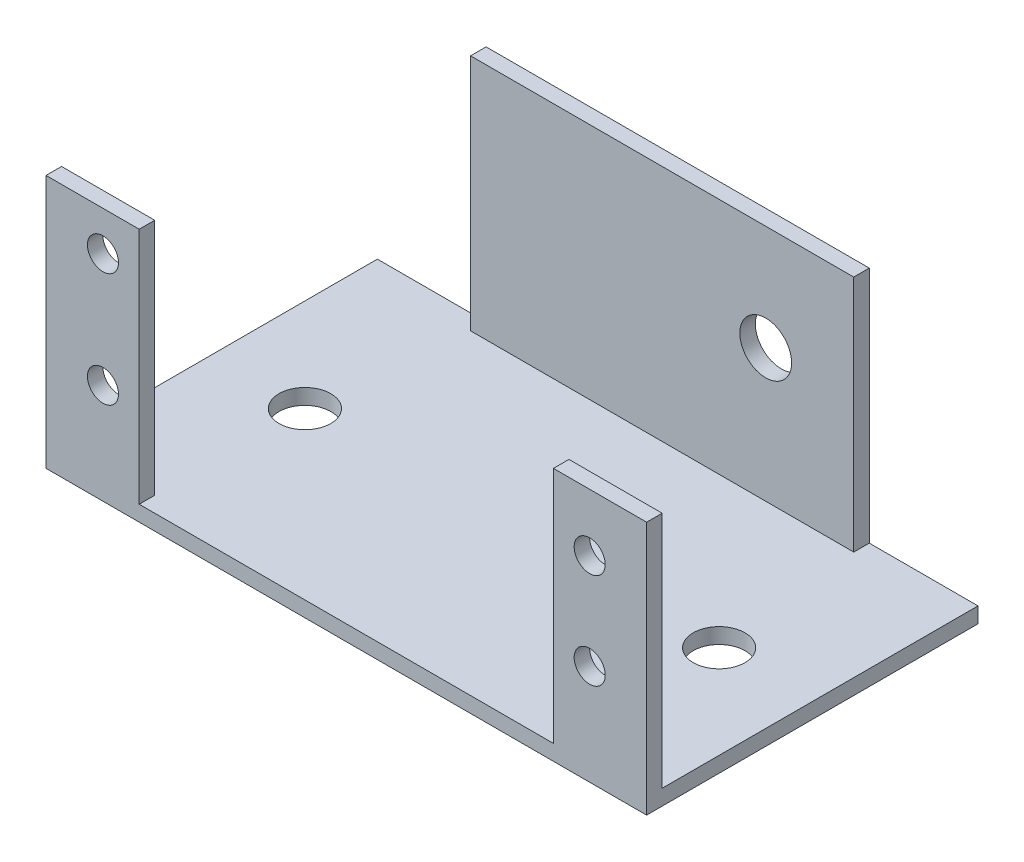
from build123d import *

# Parameters (mm, degrees)
SKETCH1_W           = 58
SKETCH1_H           = 32
BOSS_EXTRUDE1_DEPTH = 1.5
SKETCH1_3_W         = 9
SKETCH1_3_H         = 1.5
BOSS_EXTRUDE2_DEPTH = 23
SKETCH2_R           = 1.5
CUT_EXTRUDE1_DEPTH  = 49.928519291
SKETCH1_4_W         = 37
SKETCH1_4_H         = 1.5
BOSS_EXTRUDE3_DEPTH = 23
SKETCH3_R           = 2.5
CUT_EXTRUDE2_DEPTH  = 48.960921592
SKETCH1_5_R         = 2.5
CUT_EXTRUDE3_DEPTH  = 25


with BuildPart() as part:
    # Sketch1 → Boss-Extrude1 (new body)
    with BuildSketch(Plane(origin=(0, 0, 0), x_dir=(1, 0, 0), z_dir=(0, 1, 0))):
        Rectangle(SKETCH1_W, SKETCH1_H)
    extrude(amount=-BOSS_EXTRUDE1_DEPTH)

    # Sketch1<3> → Boss-Extrude2 (add)
    with BuildSketch(Plane(origin=(0, 0, 0), x_dir=(1, 0, 0), z_dir=(0, 1, 0))):
        with Locations((-24.5, -15.25)):
            Rectangle(SKETCH1_3_W, SKETCH1_3_H)
        with Locations((24.5, -15.25)):
            Rectangle(SKETCH1_3_W, SKETCH1_3_H)
    extrude(amount=BOSS_EXTRUDE2_DEPTH)

    # Sketch2 → Cut-Extrude1 (cut, through all)
    with BuildSketch(Plane.XY.offset(16)):
        with Locations((-23.5, 19.197487824)):
            Circle(SKETCH2_R)
        with Locations((-23.5, 8.197487824)):
            Circle(SKETCH2_R)
        with Locations((23.5, 17.446590768)):
            Circle(SKETCH2_R)
        with Locations((23.5, 8.197487824)):
            Circle(SKETCH2_R)
    extrude(amount=-CUT_EXTRUDE1_DEPTH, mode=Mode.SUBTRACT)

    # Sketch1<4> → Boss-Extrude3 (add)
    with BuildSketch(Plane(origin=(0, 0, 0), x_dir=(1, 0, 0), z_dir=(0, 1, 0))):
        with Locations((0, 15.25)):
            Rectangle(SKETCH1_4_W, SKETCH1_4_H)
    extrude(amount=BOSS_EXTRUDE3_DEPTH)

    # Sketch3 → Cut-Extrude2 (cut, through all)
    with BuildSketch(Plane.XY.offset(-14.5)):
        with Locations((10, 12.822039296)):
            Circle(SKETCH3_R)
    extrude(amount=-CUT_EXTRUDE2_DEPTH, mode=Mode.SUBTRACT)

    # Sketch1<5> → Cut-Extrude3 (cut)
    with BuildSketch(Plane(origin=(0, 0, 0), x_dir=(1, 0, 0), z_dir=(0, 1, 0))):
        with Locations((-20, 0)):
            Circle(SKETCH1_5_R)
        with Locations((20, 0)):
            Circle(SKETCH1_5_R)
    extrude(amount=-CUT_EXTRUDE3_DEPTH, mode=Mode.SUBTRACT)


solid = part.part
